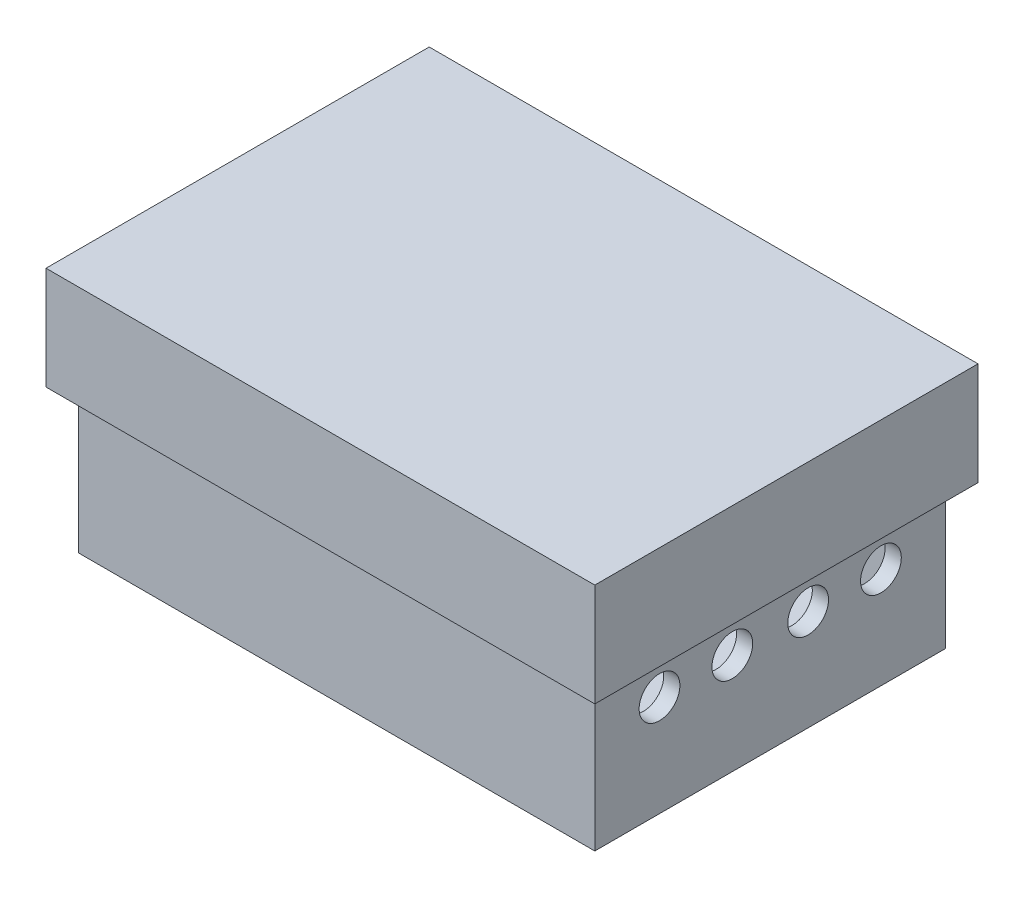
from build123d import *

# Parameters (mm, degrees)
SKETCH1_W           = 202.7
SKETCH1_H           = 137.7
SKETCH1_W_2         = 190
SKETCH1_H_2         = 125
BOSS_EXTRUDE1_DEPTH = 65
SKETCH2_W           = 202.7
SKETCH2_H           = 137.7
BOSS_EXTRUDE2_DEPTH = 6.35
CUT_EXTRUDE1_REACH  = 225.724
SKETCH3_R           = 8
SKETCH4_W           = 215.4
SKETCH4_H           = 150.4
SKETCH4_W_2         = 202.7
SKETCH4_H_2         = 137.7
BOSS_EXTRUDE3_DEPTH = 15
SKETCH5_W           = 215.4
SKETCH5_H           = 150.4
BOSS_EXTRUDE4_DEPTH = 25.4


with BuildPart() as part:
    # Sketch1 → Boss-Extrude1 (new body)
    with BuildSketch(Plane(origin=(0, 0, 0), x_dir=(1, 0, 0), z_dir=(0, 1, 0))):
        Rectangle(SKETCH1_W, SKETCH1_H)
        Rectangle(SKETCH1_W_2, SKETCH1_H_2, mode=Mode.SUBTRACT)
    extrude(amount=BOSS_EXTRUDE1_DEPTH)

    # Sketch2 → Boss-Extrude2 (add)
    with BuildSketch(Plane.XZ):
        Rectangle(SKETCH2_W, SKETCH2_H)
    extrude(amount=BOSS_EXTRUDE2_DEPTH)

    # Sketch3 → Cut-Extrude1 (cut, up to next)
    with BuildSketch(Plane.ZY.offset(-101.35), mode=Mode.PRIVATE) as cut_extrude1_sk1:
        with Locations((14.875, 33.25)):
            Circle(SKETCH3_R)
    cut_extrude1_tool1 = extrude(cut_extrude1_sk1.sketch, amount=CUT_EXTRUDE1_REACH, mode=Mode.PRIVATE) & part.part
    # Sketch3 → Cut-Extrude1 (cut, up to next)
    with BuildSketch(Plane.ZY.offset(-101.35), mode=Mode.PRIVATE) as cut_extrude1_sk2:
        with Locations((43.45, 33.25)):
            Circle(SKETCH3_R)
    cut_extrude1_tool2 = extrude(cut_extrude1_sk2.sketch, amount=CUT_EXTRUDE1_REACH, mode=Mode.PRIVATE) & part.part
    cut_extrude1_1 = cut_extrude1_tool1.solids().sort_by_distance((101.35, 33.25, 14.875))[0]
    add(cut_extrude1_1, mode=Mode.SUBTRACT)
    cut_extrude1_2 = cut_extrude1_tool2.solids().sort_by_distance((101.35, 33.25, 43.45))[0]
    add(cut_extrude1_2, mode=Mode.SUBTRACT)
    cut_extrude1 = cut_extrude1_1 + cut_extrude1_2  # Cut-Extrude1 as one shape, for the pattern or mirror that repeats it

    # Mirror1: Cut-Extrude1 across plane
    add(cut_extrude1.mirror(Plane.XY), mode=Mode.SUBTRACT)

    # Sketch4 → Boss-Extrude3 (add)
    with BuildSketch(Plane(origin=(0, 65, 0), x_dir=(1, 0, 0), z_dir=(0, 1, 0))):
        Rectangle(SKETCH4_W, SKETCH4_H)
        Rectangle(SKETCH4_W_2, SKETCH4_H_2, mode=Mode.SUBTRACT)
    extrude(amount=-BOSS_EXTRUDE3_DEPTH)

    # Sketch5 → Boss-Extrude4 (add)
    with BuildSketch(Plane(origin=(0, 65, 0), x_dir=(1, 0, 0), z_dir=(0, 1, 0))):
        Rectangle(SKETCH5_W, SKETCH5_H)
    extrude(amount=BOSS_EXTRUDE4_DEPTH)


solid = part.part
